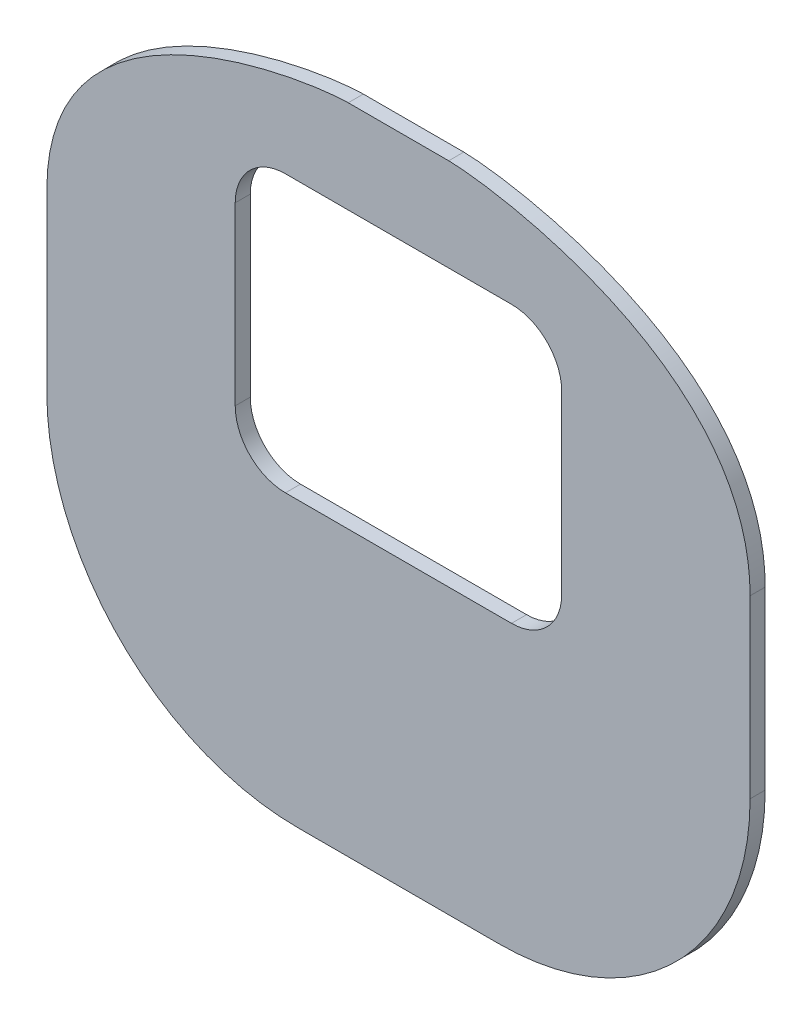
from build123d import *

# Parameters (mm, degrees)
BOSS_EXTRUDE1_DEPTH = 3
CUT_EXTRUDE1_DEPTH  = 10


with BuildPart() as part:
    # Sketch1 → Boss-Extrude1 (new body)
    with BuildSketch(Plane.XY):
        with BuildLine():
            add(Edge.make_bspline(
                [(-70, -11.5), (-70, 26.5), (-18, 33.5), (-10, 33.5)],
                knots=[0, 0, 0, 0, 1, 1, 1, 1], degree=3))
            Line((-70, -11.5), (-70, -46.5))
            ThreePointArc((-70, -46.5), (-55.355339059, -81.855339059), (-20, -96.5))
            Line((-20, -96.5), (20, -96.5))
            ThreePointArc((20, -96.5), (55.355339059, -81.855339059), (70, -46.5))
            Line((70, -46.5), (70, -11.5))
            add(Edge.make_bspline(
                [(10, 33.5), (18, 33.5), (70, 26.5), (70, -11.5)],
                knots=[0, 0, 0, 0, 1, 1, 1, 1], degree=3))
            Line((10, 33.5), (-10, 33.5))
        make_face()
    extrude(amount=BOSS_EXTRUDE1_DEPTH)

    # Sketch2 → Cut-Extrude1 (cut)
    with BuildSketch(Plane.XY.offset(3)):
        with BuildLine():
            Line((-22.5, -40), (22.5, -40))
            ThreePointArc((22.5, -40), (29.571067812, -37.071067812), (32.5, -30))
            Line((32.5, -30), (32.5, 5))
            ThreePointArc((32.5, 5), (29.571067812, 12.071067812), (22.5, 15))
            Line((22.5, 15), (-22.5, 15))
            ThreePointArc((-22.5, 15), (-29.571067812, 12.071067812), (-32.5, 5))
            Line((-32.5, 5), (-32.5, -30))
            ThreePointArc((-32.5, -30), (-29.571067812, -37.071067812), (-22.5, -40))
        make_face()
    extrude(amount=-CUT_EXTRUDE1_DEPTH, mode=Mode.SUBTRACT)


solid = part.part
